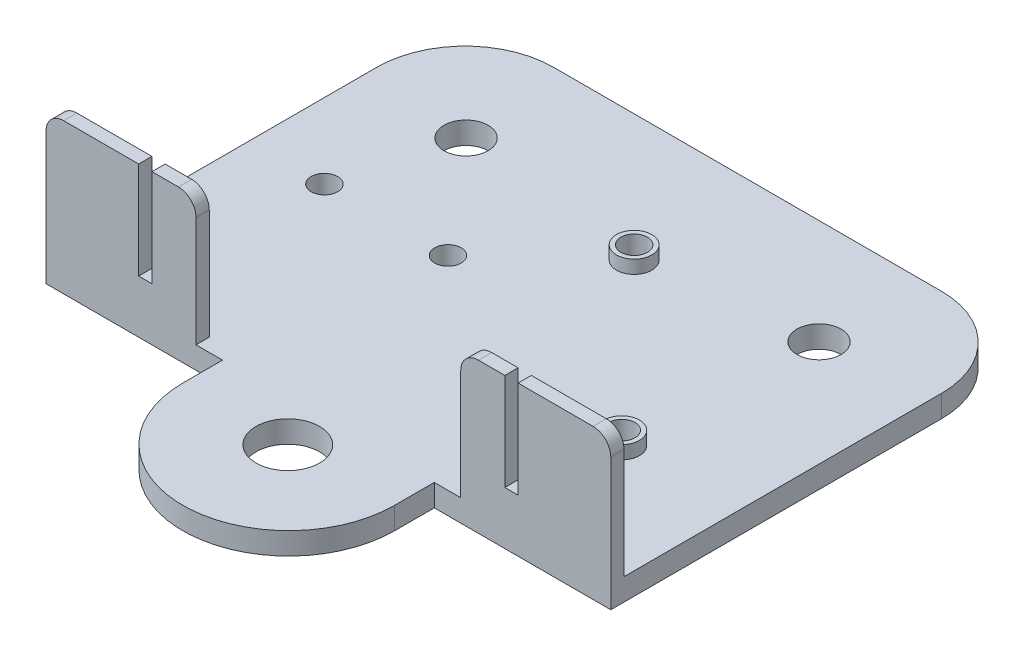
from build123d import *

# Parameters (mm, degrees)
SKETCH1_R                = 3.6
SKETCH1_R_2              = 2.5
MAIN_BOSS_DEPTH          = 2.5
SKETCH2_R                = 2
SMALL_HOLE_EXTRUDE_DEPTH = 1.5
SKETCH3_R                = 1.5
SMALL_HOLE_DEPTH         = 58.412977627
SKETCH4_R                = 2
LONG_HOLE_EXTRUDE_DEPTH  = 4.5
SKETCH5_R                = 1.5
LONG_HOLE_DEPTH          = 58.900777197
SIDE_BOSS_DEPTH          = 1.5


with BuildPart() as part:
    # Sketch1 → main boss (new body)
    with BuildSketch(Plane(origin=(0, 0, 0), x_dir=(1, 0, 0), z_dir=(0, 1, 0))):
        with BuildLine():
            Line((32, 0), (12, 0))
            Line((12, 0), (12, -4.5))
            ThreePointArc((12, -4.5), (0, -16.5), (-12, -4.5))
            Line((-12, -4.5), (-12, 0))
            Line((-12, 0), (-32, 0))
            Line((-32, 0), (-32, 37.5))
            ThreePointArc((-32, 37.5), (-29.071067812, 44.571067812), (-22, 47.5))
            Line((-22, 47.5), (22, 47.5))
            ThreePointArc((22, 47.5), (29.071067812, 44.571067812), (32, 37.5))
            Line((32, 37.5), (32, 0))
        make_face()
        with Locations(Location((0, -4.6, 0), (0, 0, 270))):
            Circle(SKETCH1_R, mode=Mode.SUBTRACT)
        with Locations(Location((20, 35.6, 0), (0, 0, 270))):
            Circle(SKETCH1_R_2, mode=Mode.SUBTRACT)
        with Locations(Location((-20, 35.6, 0), (0, 0, 270))):
            Circle(SKETCH1_R_2, mode=Mode.SUBTRACT)
    extrude(amount=MAIN_BOSS_DEPTH)

    # Sketch2 → small hole extrude (add)
    with BuildSketch(Plane(origin=(0, 2.5, 0), x_dir=(1, 0, 0), z_dir=(0, 1, 0))):
        with Locations(Location((1.5, 33.15, 0), (0, 0, 270))):
            Circle(SKETCH2_R)
        with Locations(Location((19, 14.25, 0), (0, 0, 270))):
            Circle(SKETCH2_R)
    extrude(amount=SMALL_HOLE_EXTRUDE_DEPTH)

    # Sketch3 → small hole (cut, through all)
    with BuildSketch(Plane(origin=(0, 4, 0), x_dir=(1, 0, 0), z_dir=(0, 1, 0))):
        with Locations(Location((1.5, 33.15, 0), (0, 0, 270))):
            Circle(SKETCH3_R)
        with Locations(Location((19, 14.25, 0), (0, 0, 270))):
            Circle(SKETCH3_R)
    extrude(amount=-SMALL_HOLE_DEPTH, mode=Mode.SUBTRACT)

    # Sketch4 → long hole extrude (add)
    with BuildSketch(Plane.XZ):
        with Locations(Location((-23.5, -23.05, 0), (0, 0, 90))):
            Circle(SKETCH4_R)
        with Locations(Location((-9.5, -23.05, 0), (0, 0, 90))):
            Circle(SKETCH4_R)
    extrude(amount=LONG_HOLE_EXTRUDE_DEPTH)

    # Sketch5 → long hole (cut, through all)
    with BuildSketch(Plane.XZ.offset(4.5)):
        with Locations(Location((-23.5, -23.05, 0), (0, 0, 270))):
            Circle(SKETCH5_R)
        with Locations(Location((-9.5, -23.05, 0), (0, 0, 270))):
            Circle(SKETCH5_R)
    extrude(amount=-LONG_HOLE_DEPTH, mode=Mode.SUBTRACT)

    # Sketch6 → side boss (add)
    with BuildSketch(Plane.XY):
        with BuildLine():
            Line((-32, 0), (-32, 15))
            ThreePointArc((-32, 15), (-31.414213562, 16.414213562), (-30, 17))
            Line((-30, 17), (-21.5, 17))
            Line((-21.5, 17), (-21.5, 6))
            Line((-21.5, 6), (-20, 6))
            Line((-20, 6), (-20, 17))
            Line((-20, 17), (-17, 17))
            ThreePointArc((-17, 17), (-15.585786438, 16.414213562), (-15, 15))
            Line((-15, 15), (-15, 0))
            Line((-15, 0), (-32, 0))
        make_face()
    side_boss = extrude(amount=-SIDE_BOSS_DEPTH)

    # Mirror1: side boss across plane
    add(side_boss.mirror(Plane(origin=(0, 0, 0), x_dir=(0, 0, 1), z_dir=(1, 0, 0))))


solid = part.part
